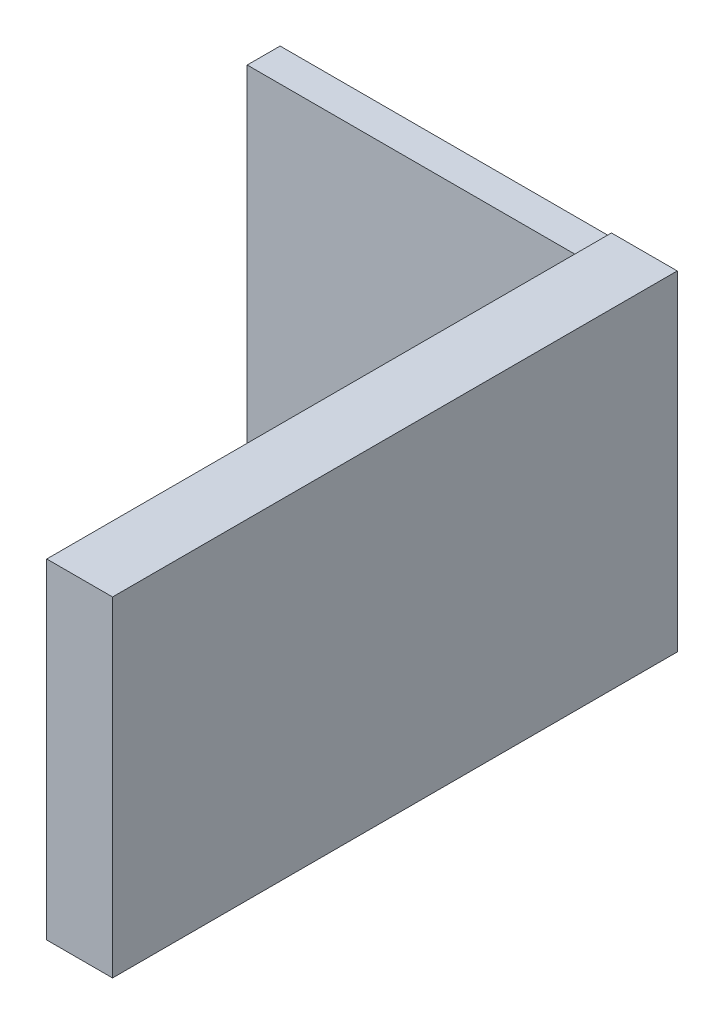
from build123d import *

# Parameters (mm, degrees)
SKETCH1_W           = 10
SKETCH1_H           = 10
BOSS_EXTRUDE1_DEPTH = 1
SKETCH2_W           = 17.164171265
SKETCH2_H           = 10.030082425
BOSS_EXTRUDE3_DEPTH = 2


with BuildPart() as part:
    # Sketch1 → Boss-Extrude1 (new body)
    with BuildSketch(Plane.XY):
        with Locations((-13.973795824, -3.95242479)):
            Rectangle(SKETCH1_W, SKETCH1_H)
    extrude(amount=BOSS_EXTRUDE1_DEPTH)

    # Sketch2 → Boss-Extrude3 (add)
    with BuildSketch(Plane(origin=(-8.973795824, 0, 0), x_dir=(0, 0, -1), z_dir=(1, 0, 0))):
        with Locations((-8.511173274, -3.923626572)):
            Rectangle(SKETCH2_W, SKETCH2_H)
    extrude(amount=BOSS_EXTRUDE3_DEPTH)


solid = part.part
